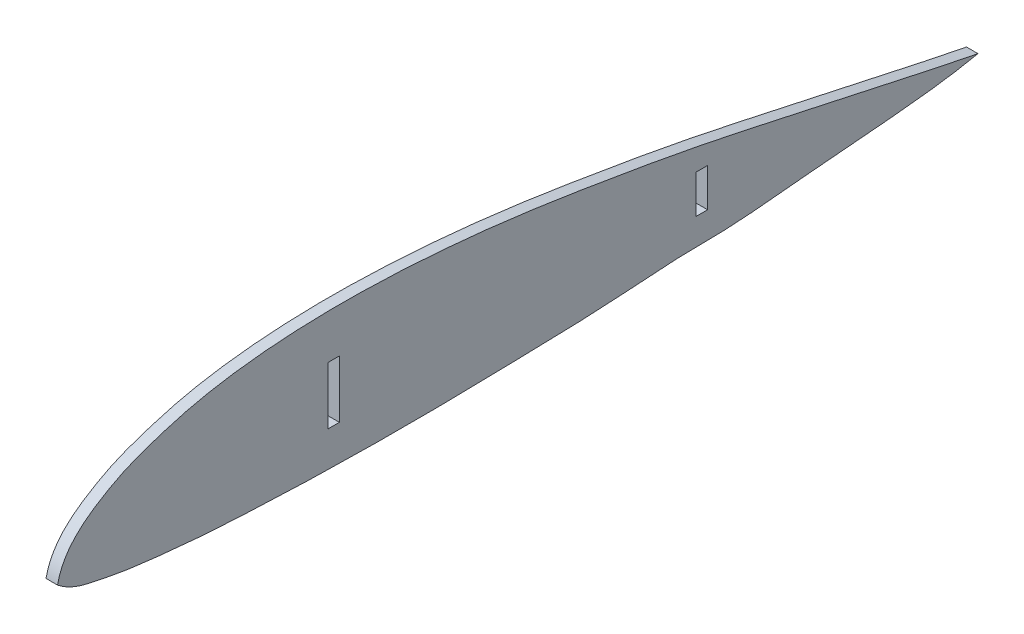
from build123d import *

# Parameters (mm, degrees)
EXTRUDE_1_DEPTH     = 3
SKETCH_2_W          = 3
SKETCH_2_H          = 15
SKETCH_2_H_2        = 10
CUT_EXTRUDE_1_DEPTH = 3


with BuildPart() as part:
    # Эскиз1 → Бобышка-Вытянуть1 (new body)
    with BuildSketch(Plane(origin=(0, 0, 0), x_dir=(0, 0, -1), z_dir=(1, 0, 0))):
        with BuildLine():
            add(Edge.make_bspline(
                [(-240, 0), (-238.539586148, 6.885975956), (-231.6119689, 12.33782744), (-222.175332595, 17.412091216), (-214.111867769, 20.343482826), (-204.156129061, 23.263904239), (-188.104616678, 25.89332168), (-168.007150597, 26.960143982), (-143.945589986, 26.026388226), (-119.918298994, 23.567750867), (-95.953760008, 19.758812003), (-71.912657951, 15.561977026), (-48.005978392, 10.220578603), (-23.989791717, 5.171383231), (-8.037469261, 1.523600682), (0, 0)],
                knots=[0, 0, 0, 0, 0.075346011, 0.102327605, 0.127890212, 0.177564304, 0.226024831, 0.321726685, 0.417300323, 0.513304723, 0.609920295, 0.706973803, 0.804635001, 0.902346226, 1, 1, 1, 1], degree=3))
            add(Edge.make_bspline(
                [(-240, 0), (-236.52391179, -2.886637123), (-230.220810861, -4.067786061), (-222.028601874, -5.648779907), (-214.009642515, -6.608514015), (-204.019456847, -7.65058139), (-188.010543644, -8.621004369), (-168.008371033, -9.355028053), (-143.997445941, -9.544655848), (-119.996434598, -9.000571646), (-95.984120714, -8.452313319), (-79.444451482, -6.861549256), (-63.412851028, -6.941357818), (-47.421480018, -5.149296578), (-23.951991061, -3.34616289), (-7.916011456, -1.672238148), (0, 0)],
                knots=[0, 0, 0, 0, 0.053475274, 0.07870931, 0.103753204, 0.153672751, 0.203448049, 0.302856431, 0.40219897, 0.501554025, 0.600954522, 0.700430481, 0.707480416, 0.799996455, 0.899715685, 1, 1, 1, 1], degree=3))
        make_face()
    extrude(amount=EXTRUDE_1_DEPTH)

    # Эскиз2 → Вырез-Вытянуть1 (cut)
    with BuildSketch(Plane.ZY):
        with Locations((168, 7.5)):
            Rectangle(SKETCH_2_W, SKETCH_2_H)
        with Locations((72, 5)):
            Rectangle(SKETCH_2_W, SKETCH_2_H_2)
    extrude(amount=-CUT_EXTRUDE_1_DEPTH, mode=Mode.SUBTRACT)


solid = part.part
